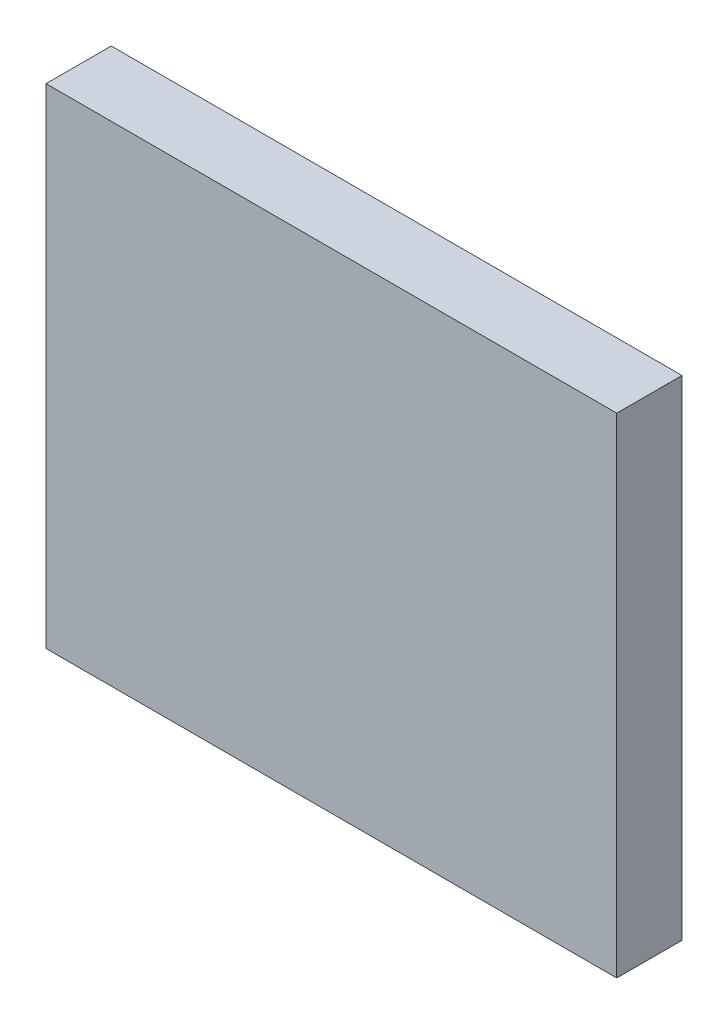
from build123d import *

# Parameters (mm, degrees)
SKETCH1_W           = 35
SKETCH1_H           = 30
BOSS_EXTRUDE1_DEPTH = 4


with BuildPart() as part:
    # Sketch1 → Boss-Extrude1 (new body)
    with BuildSketch(Plane.XY):
        with Locations((17.5, 15)):
            Rectangle(SKETCH1_W, SKETCH1_H)
    extrude(amount=BOSS_EXTRUDE1_DEPTH)


solid = part.part
